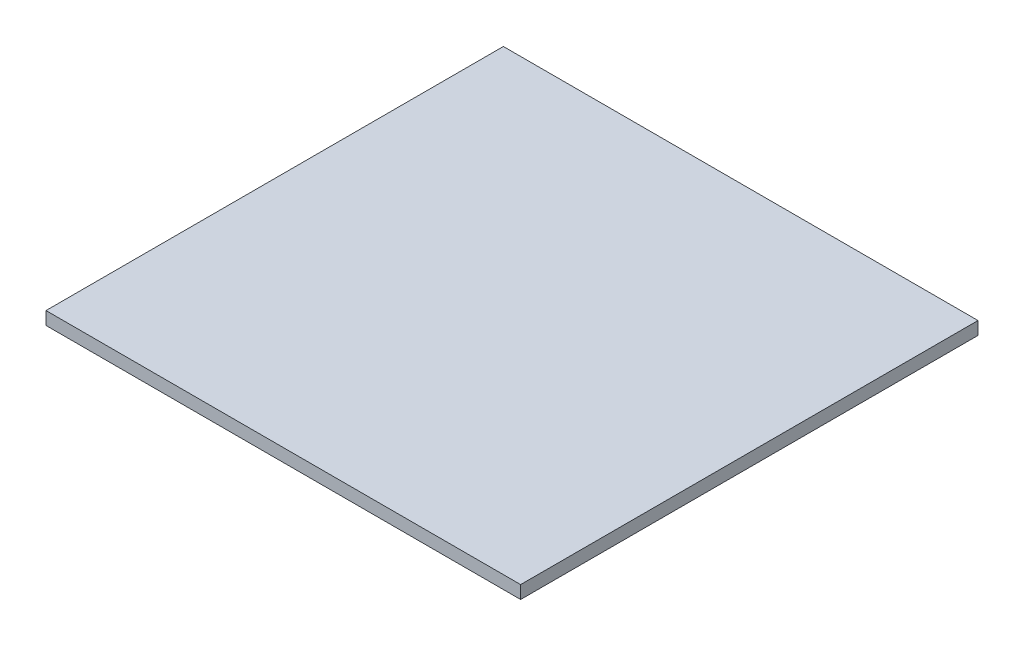
from build123d import *

# Parameters (mm, degrees)
SKETCH1_W           = 55
SKETCH1_H           = 53
BOSS_EXTRUDE1_DEPTH = 1.5


with BuildPart() as part:
    # Sketch1 → Boss-Extrude1 (new body)
    with BuildSketch(Plane(origin=(0, 0, 0), x_dir=(1, 0, 0), z_dir=(0, 1, 0))):
        Rectangle(SKETCH1_W, SKETCH1_H)
    extrude(amount=BOSS_EXTRUDE1_DEPTH)


solid = part.part
